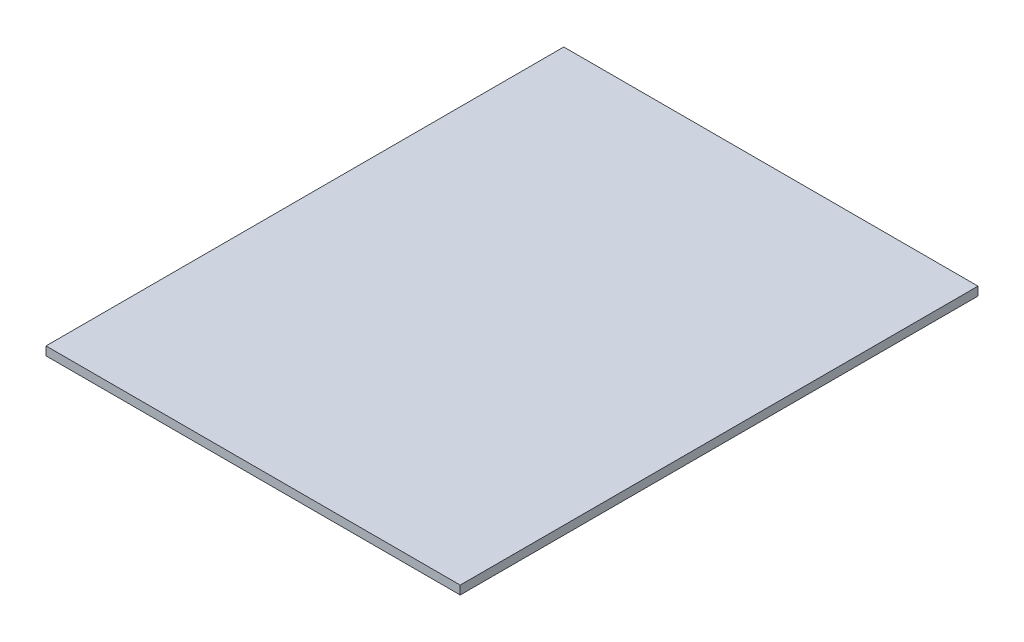
from build123d import *

# Parameters (mm, degrees)
SKETCH1_W           = 304.8
SKETCH1_H           = 381
BOSS_EXTRUDE1_DEPTH = 6.35


with BuildPart() as part:
    # Sketch1 → Boss-Extrude1 (new body)
    with BuildSketch(Plane(origin=(0, 0, 0), x_dir=(1, 0, 0), z_dir=(0, 1, 0))):
        with Locations((2.4, 40.5)):
            Rectangle(SKETCH1_W, SKETCH1_H)
    extrude(amount=BOSS_EXTRUDE1_DEPTH)


solid = part.part
